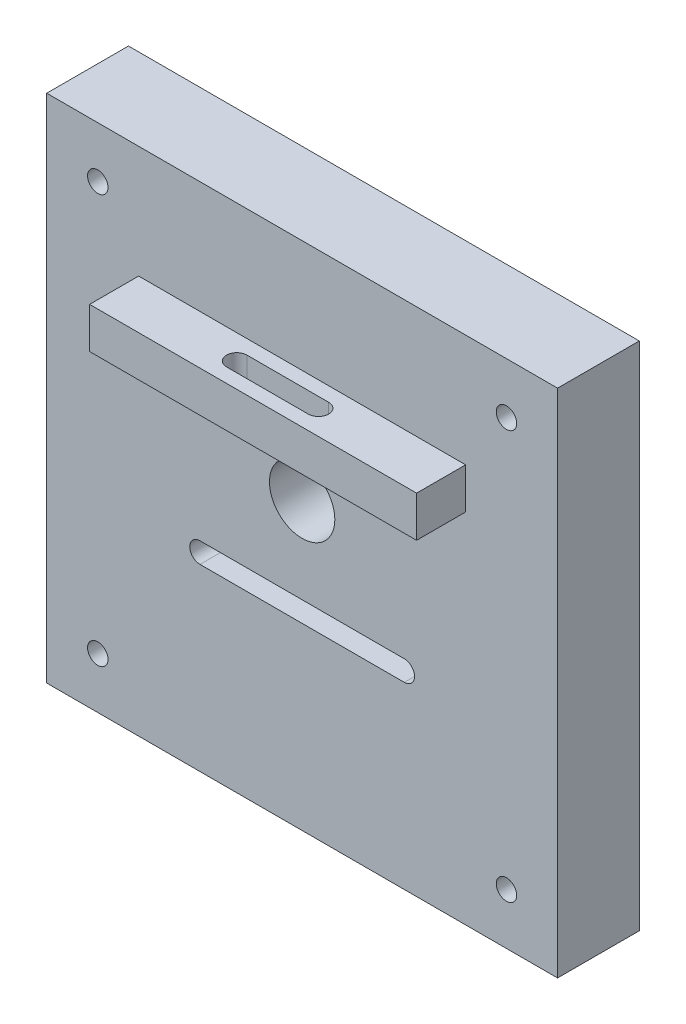
from build123d import *

# Parameters (mm, degrees)
SKETCH1_W           = 125
SKETCH1_H           = 125
BOSS_EXTRUDE1_DEPTH = 20
SKETCH2_R           = 2.5
CUT_EXTRUDE1_DEPTH  = 95.375743383
SKETCH3_R           = 8
CUT_EXTRUDE2_DEPTH  = 95.375743383
SKETCH4_W           = 70
SKETCH4_H           = 15
CUT_EXTRUDE3_DEPTH  = 10
FILLET1_R           = 5
SKETCH6_W           = 80
SKETCH6_H           = 10
BOSS_EXTRUDE2_DEPTH = 12
CUT_EXTRUDE4_DEPTH  = 123.375593875


with BuildPart() as part:
    # Sketch1 → Boss-Extrude1 (new body)
    with BuildSketch(Plane.XY):
        with Locations((4.174852652, 1.227897839)):
            Rectangle(SKETCH1_W, SKETCH1_H)
    extrude(amount=BOSS_EXTRUDE1_DEPTH)

    # Sketch2 → Cut-Extrude1 (cut, through all)
    with BuildSketch(Plane.XY.offset(20)):
        with Locations((-45.825147348, 51.227897839)):
            Circle(SKETCH2_R)
        with Locations((54.174852652, 51.227897839)):
            Circle(SKETCH2_R)
        with Locations((54.174852652, -48.772102161)):
            Circle(SKETCH2_R)
        with Locations((-45.825147348, -48.772102161)):
            Circle(SKETCH2_R)
    extrude(amount=-CUT_EXTRUDE1_DEPTH, mode=Mode.SUBTRACT)

    # Sketch3 → Cut-Extrude2 (cut, through all)
    with BuildSketch(Plane.XY.offset(20)):
        with Locations((4.174852652, 8.627897839)):
            Circle(SKETCH3_R)
        with BuildLine():
            Line((-20.825147348, -12.372102161), (29.174852652, -12.372102161))
            ThreePointArc((29.174852652, -12.372102161), (31.674852652, -14.872102161), (29.174852652, -17.372102161))
            Line((29.174852652, -17.372102161), (-20.825147348, -17.372102161))
            ThreePointArc((-20.825147348, -17.372102161), (-23.325147348, -14.872102161), (-20.825147348, -12.372102161))
        make_face()
    extrude(amount=-CUT_EXTRUDE2_DEPTH, mode=Mode.SUBTRACT)

    # Sketch4 → Cut-Extrude3 (cut)
    with BuildSketch(Plane(origin=(0, 0, 0), x_dir=(-1, 0, 0), z_dir=(0, 0, -1))):
        with Locations((-4.174852652, -14.872102161)):
            Rectangle(SKETCH4_W, SKETCH4_H)
    extrude(amount=-CUT_EXTRUDE3_DEPTH, mode=Mode.SUBTRACT)

    # Fillet1
    fillet1_edges = [part.edges().sort_by_distance(p)[0] for p in [
        (39.174852652, -22.372102161, 5),
        (39.174852652, -7.372102161, 5),
        (-30.825147348, -7.372102161, 5),
        (-30.825147348, -22.372102161, 5),
    ]]
    fillet(fillet1_edges, radius=FILLET1_R)

    # Sketch6 → Boss-Extrude2 (add)
    with BuildSketch(Plane.XY.offset(20)):
        with Locations((4.174852652, 31.227897839)):
            Rectangle(SKETCH6_W, SKETCH6_H)
    extrude(amount=BOSS_EXTRUDE2_DEPTH)

    # Sketch7 → Cut-Extrude4 (cut, through all)
    with BuildSketch(Plane(origin=(0, 36.227897839, 0), x_dir=(1, 0, 0), z_dir=(0, 1, 0))):
        with BuildLine():
            Line((-5.825147348, -28.5), (14.174852652, -28.5))
            ThreePointArc((14.174852652, -28.5), (16.674852652, -26), (14.174852652, -23.5))
            Line((14.174852652, -23.5), (-5.825147348, -23.5))
            ThreePointArc((-5.825147348, -23.5), (-8.325147348, -26), (-5.825147348, -28.5))
        make_face()
    extrude(amount=-CUT_EXTRUDE4_DEPTH, mode=Mode.SUBTRACT)


solid = part.part
